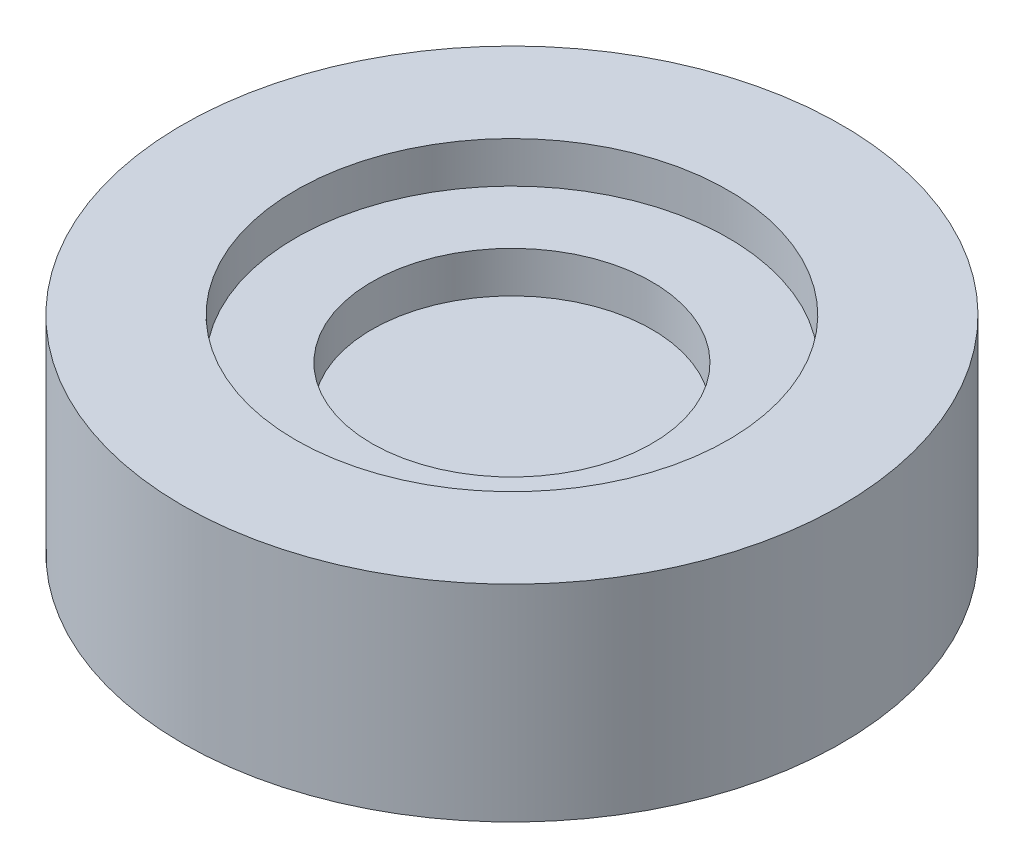
from build123d import *

# Parameters (mm, degrees)
SKETCH1_R           = 8
BOSS_EXTRUDE1_DEPTH = 5
SKETCH2_W           = 6.4
SKETCH2_H           = 3.2
CUT_EXTRUDE1_DEPTH  = 2


with BuildPart() as part:
    # Sketch1 → Boss-Extrude1 (new body)
    with BuildSketch(Plane(origin=(0, 0, 0), x_dir=(1, 0, 0), z_dir=(0, 1, 0))):
        with Locations(Location((0, 0, 0), (0, 0, 270))):
            Circle(SKETCH1_R)
    extrude(amount=BOSS_EXTRUDE1_DEPTH)

    # Sketch2 → Cut-Extrude1 (cut)
    with BuildSketch(Plane.XZ):
        Rectangle(SKETCH2_W, SKETCH2_H)
    extrude(amount=-CUT_EXTRUDE1_DEPTH, mode=Mode.SUBTRACT)

    # Sketch3 → Cut-Revolve1 (revolve, cut)
    with BuildSketch(Plane.XY, mode=Mode.PRIVATE) as cut_revolve1_sk:
        Polygon((0, 3), (-3.4, 3), (-3.4, 4), (-5.25, 4), (-5.25, 5), (0, 5), align=None)
    revolve(cut_revolve1_sk.sketch.rotate(Axis((0, 0, 0), (0, -1, 0)), 270), axis=Axis((0, 0, 0), (0, -1, 0)), mode=Mode.SUBTRACT)


solid = part.part
